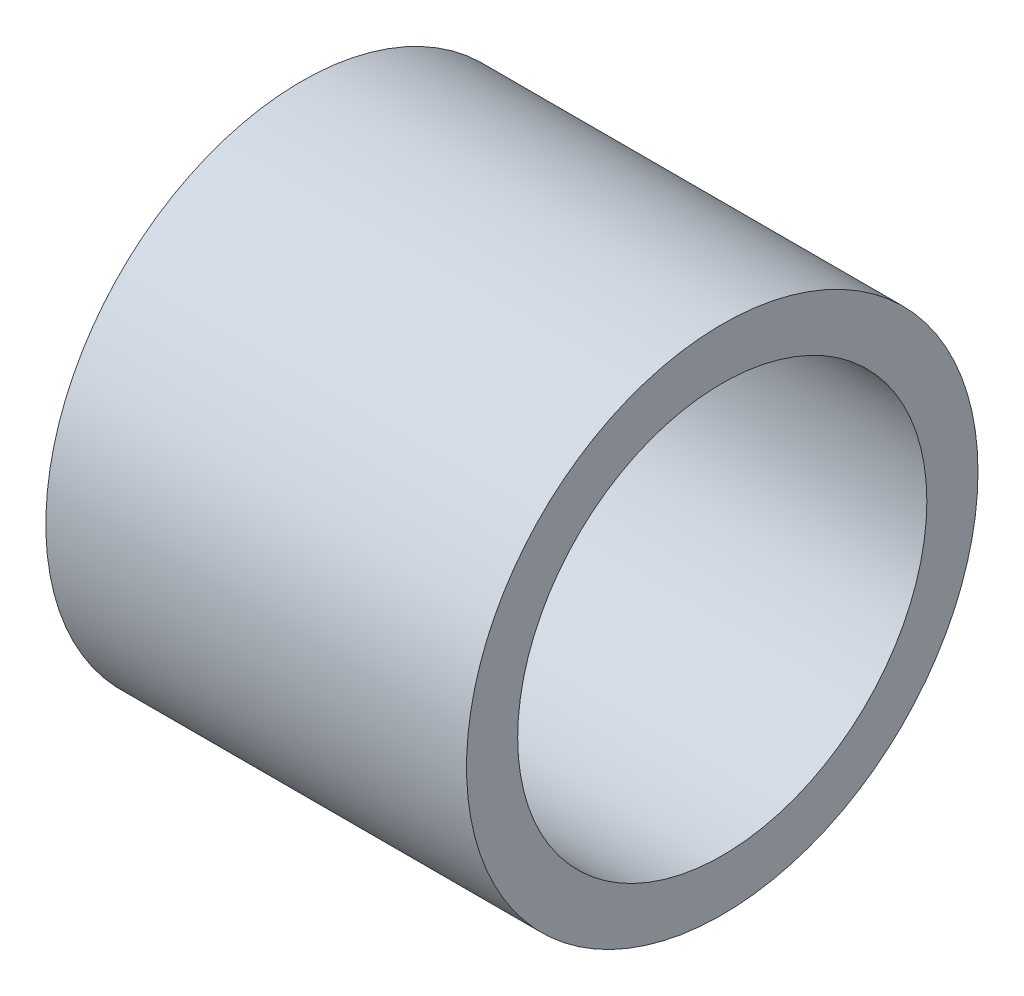
from build123d import *

# Parameters (mm, degrees)
SKETCH1_R      = 15.875
SKETCH1_R_2    = 12.7
EXTRUDE1_DEPTH = 26.115


with BuildPart() as part:
    # Sketch1 → Extrude1 (new body)
    with BuildSketch(Plane(origin=(0, 0, 0), x_dir=(0, 0, -1), z_dir=(1, 0, 0))):
        Circle(SKETCH1_R)
        Circle(SKETCH1_R_2, mode=Mode.SUBTRACT)
    extrude(amount=EXTRUDE1_DEPTH)


solid = part.part
